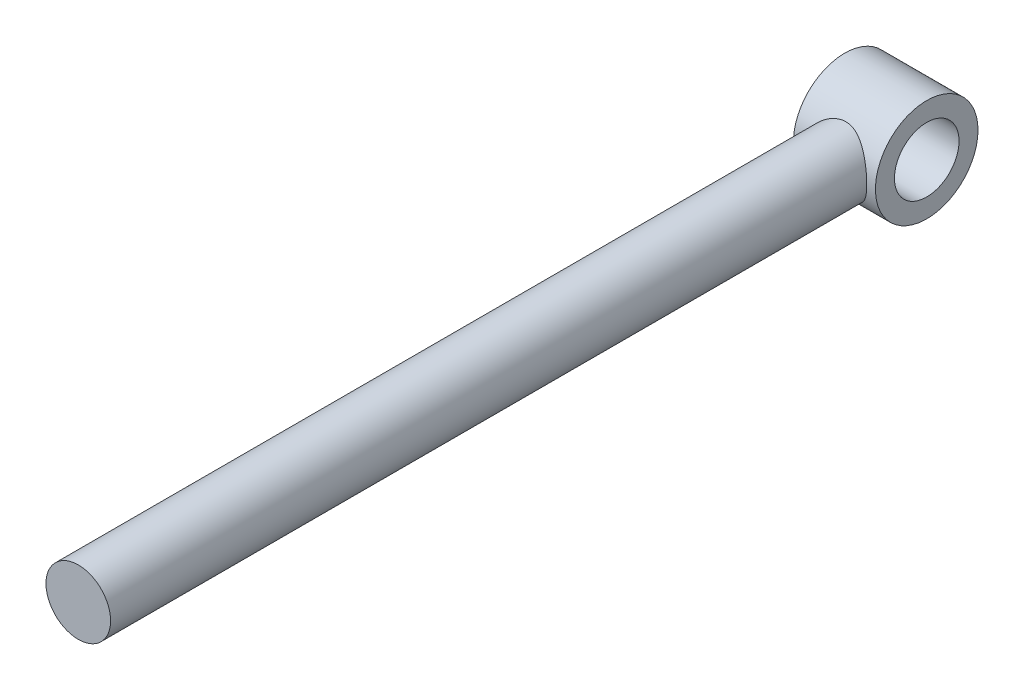
from build123d import *

# Parameters (mm, degrees)
SKETCH2_R           = 4
BOSS_EXTRUDE1_DEPTH = 100
SKETCH1_R           = 6.35
BOSS_EXTRUDE2_DEPTH = 5.08
SKETCH1_3_R         = 4
CUT_EXTRUDE1_DEPTH  = 5.08


with BuildPart() as part:
    # Sketch2 → Boss-Extrude1 (new body)
    with BuildSketch(Plane(origin=(0, 0, 0), x_dir=(0, 1, 0), z_dir=(0, 0, 1))):
        Circle(SKETCH2_R)
    extrude(amount=BOSS_EXTRUDE1_DEPTH)

    # Sketch1 → Boss-Extrude2 (add, symmetric)
    with BuildSketch(Plane.YZ):
        Circle(SKETCH1_R)
    extrude(amount=BOSS_EXTRUDE2_DEPTH, both=True)

    # Sketch1<3> → Cut-Extrude1 (cut, symmetric)
    with BuildSketch(Plane.YZ):
        Circle(SKETCH1_3_R)
    extrude(amount=CUT_EXTRUDE1_DEPTH, both=True, mode=Mode.SUBTRACT)


solid = part.part
